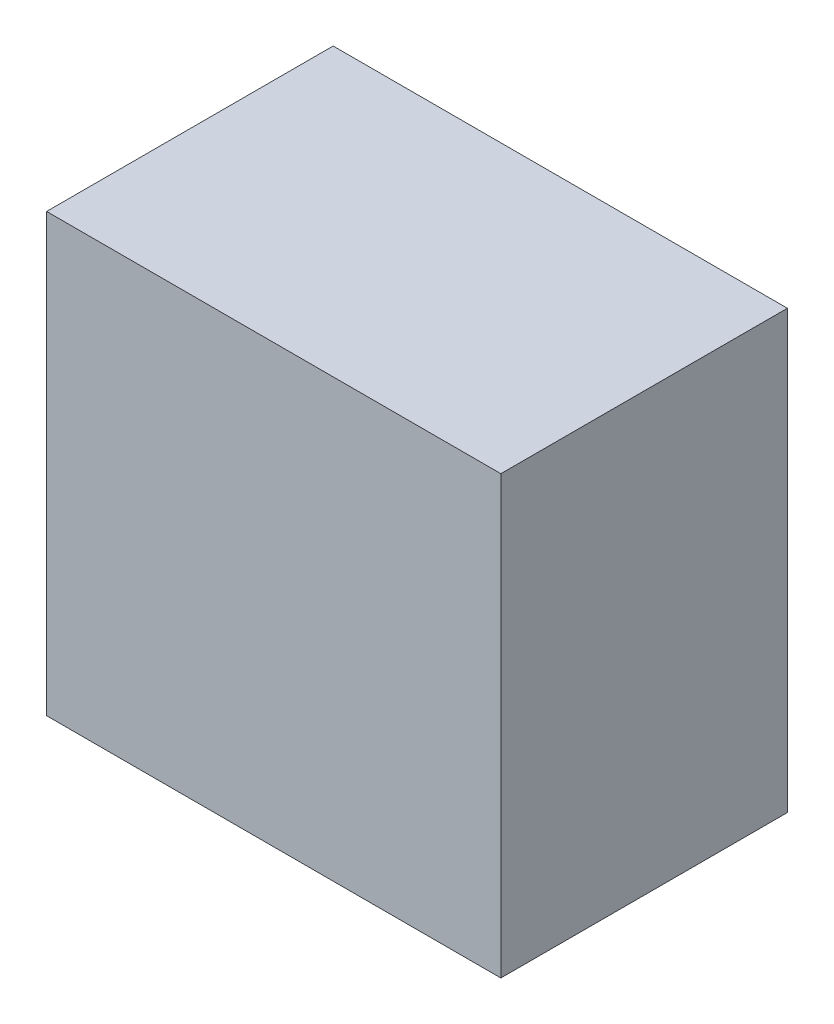
from build123d import *

# Parameters (mm, degrees)
SKETCH1_W           = 31.704484081
SKETCH1_H           = 30.485080847
BOSS_EXTRUDE1_DEPTH = 20


with BuildPart() as part:
    # Sketch1 → Boss-Extrude1 (new body)
    with BuildSketch(Plane.XY):
        with Locations((15.852242041, 15.242540424)):
            Rectangle(SKETCH1_W, SKETCH1_H)
    extrude(amount=BOSS_EXTRUDE1_DEPTH)


solid = part.part
